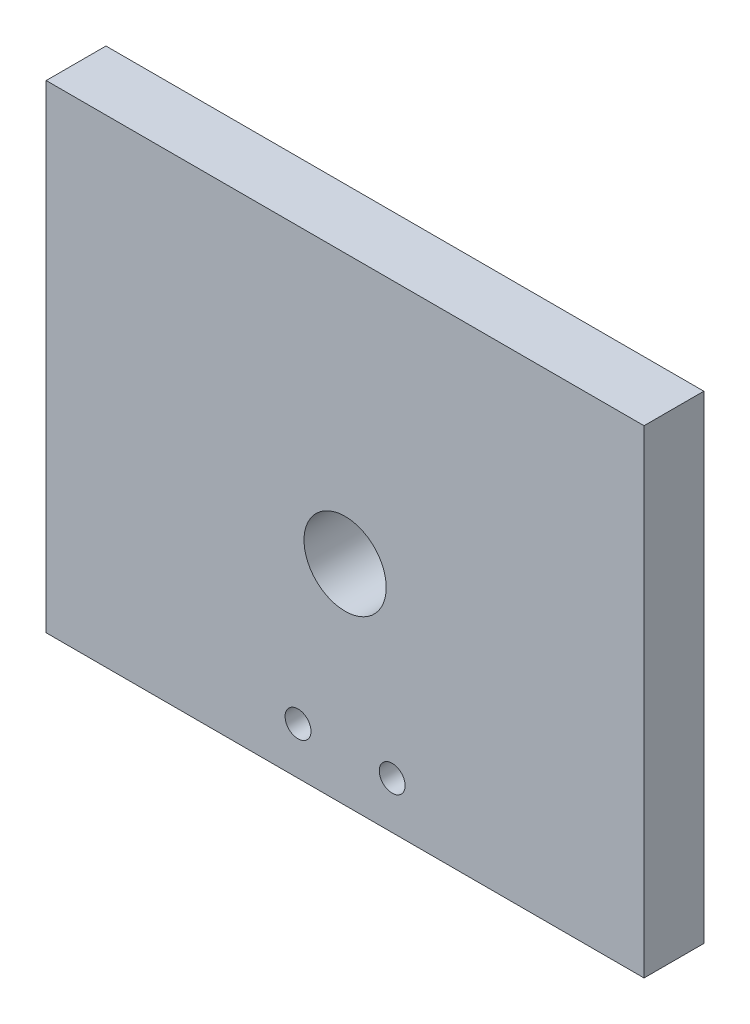
from build123d import *

# Parameters (mm, degrees)
SKETCH1_W            = 127
SKETCH1_H            = 101.6
BOSS_EXTRUDE1_DEPTH  = 6.35
HOLE2_D              = 17.4625
M4_CLEARANCE_HOLE1_D = 5.5


with BuildPart() as part:
    # Sketch1 → Boss-Extrude1 (new, symmetric)
    with BuildSketch(Plane.XY):
        Rectangle(SKETCH1_W, SKETCH1_H)
    extrude(amount=BOSS_EXTRUDE1_DEPTH, both=True)

    # Hole2 (through all)
    with Locations(Plane.XY.offset(6.35)):
        with Locations((0, -6.35)):
            Hole(HOLE2_D / 2)

    # M4 Clearance Hole1 (through all)
    with Locations(Plane.XY.offset(6.35)):
        with Locations((-10, -40.8), (10, -40.8)):
            Hole(M4_CLEARANCE_HOLE1_D / 2)


solid = part.part
